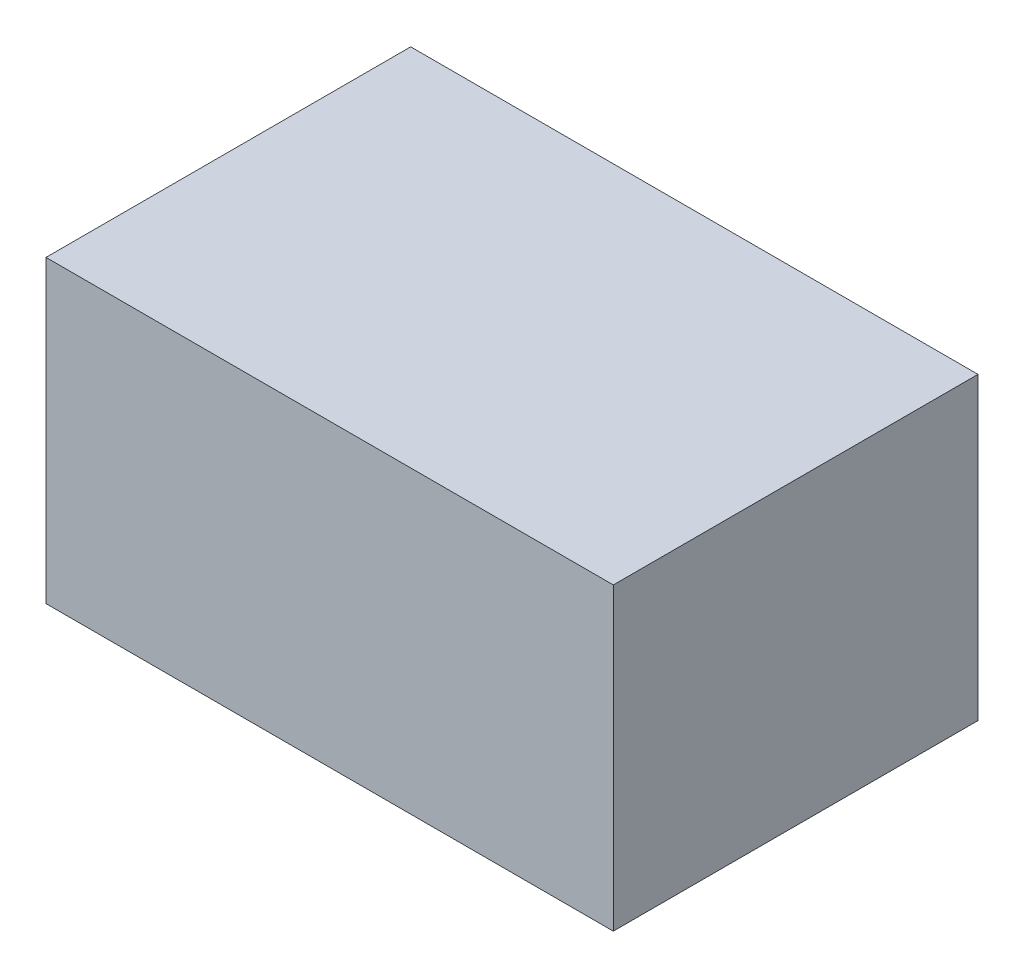
from build123d import *

# Parameters (mm, degrees)
SKETCH1_W           = 7
SKETCH1_H           = 4.5
BOSS_EXTRUDE1_DEPTH = 3.7


with BuildPart() as part:
    # Sketch1 → Boss-Extrude1 (new body)
    with BuildSketch(Plane(origin=(0, 0, 0), x_dir=(1, 0, 0), z_dir=(0, 1, 0))):
        with Locations((3.5, 2.25)):
            Rectangle(SKETCH1_W, SKETCH1_H)
    extrude(amount=BOSS_EXTRUDE1_DEPTH)


solid = part.part
